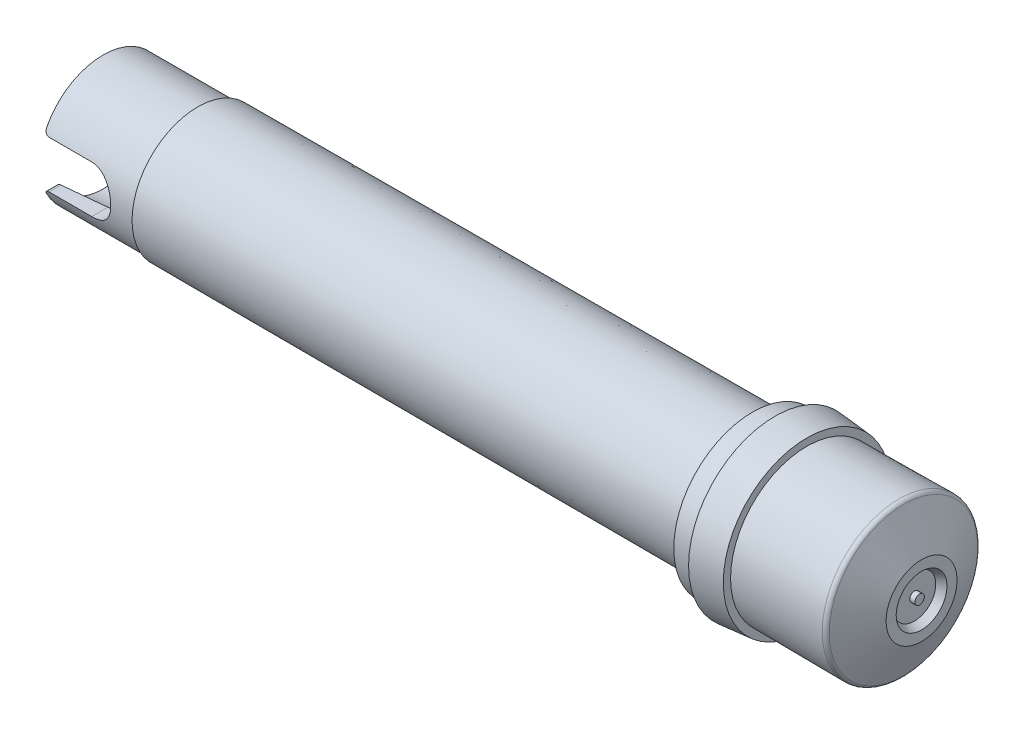
from build123d import *

# Parameters (mm, degrees)
EXTRUS_O1_DEPTH = 5
FILETE1_R       = 0.1
FILETE2_R       = 0.2
FILETE3_R       = 0.03


with BuildPart() as part:
    # Esboço1 → Revolução1 (revolve)
    with BuildSketch(Plane.XY, mode=Mode.PRIVATE) as revolu_o1_sk:
        with BuildLine():
            Line((0, 2.232465991), (0, 2.675))
            Line((0, 2.675), (4, 2.675))
            Line((4, 2.675), (4, 2.775))
            Line((4, 2.775), (27.45, 2.825))
            Line((27.45, 2.825), (27.45, 3.325))
            Line((27.45, 3.325), (28.4, 3.325))
            Line((28.4, 3.325), (28.4, 3.65))
            Line((28.4, 3.65), (29.75, 3.531890304))
            Line((29.75, 3.531890304), (29.75, 3.225))
            Line((29.75, 3.225), (33.653170972, 3.254044116))
            ThreePointArc((33.653170972, 3.254044116), (33.761490772, 3.223126579), (33.83592072, 3.138573305))
            Line((33.83592072, 3.138573305), (34.6, 1.5))
            Line((34.6, 1.5), (34.6, 1.073205081))
            Line((34.6, 1.073205081), (34.3, 0.9))
            Line((34.3, 0.9), (34.3, 0.2))
            Line((34.3, 0.2), (34.517634594, 0.2))
            Line((34.517634594, 0.2), (34.517634594, 0))
            Line((34.517634594, 0), (33.7, 0))
            Line((33.7, 0), (33.7, 1.652085159))
            Line((33.7, 1.652085159), (3, 1.92))
            Line((3, 1.92), (3, 1.97))
            Line((3, 1.97), (0, 2.232465991))
        make_face()
    revolve(revolu_o1_sk.sketch.rotate(Axis((0, 0, 0), (1, 0, 0)), 90), axis=Axis((0, 0, 0), (1, 0, 0)))

    # Esboço2 → Extrusão1 (cut, symmetric)
    with BuildSketch(Plane.XY):
        with BuildLine():
            Line((0, 1), (0, -1))
            Line((0, -1), (2, -1))
            ThreePointArc((2, -1), (3, 0), (2, 1))
            Line((2, 1), (0, 1))
        make_face()
    extrude(amount=EXTRUS_O1_DEPTH, both=True, mode=Mode.SUBTRACT)

    # Filete1
    filete1_edges = [part.edges().sort_by_distance(p)[0] for p in [
        (33.7, 0, -1.652085159),
    ]]
    fillet(filete1_edges, radius=FILETE1_R)

    # Filete2
    filete2_edges = [part.edges().sort_by_distance(p)[0] for p in [
        (0, -1, -2.238512624),
        (0, -1, 2.238512624),
        (0, 1, -2.238512624),
        (0, 1, 2.238512624),
    ]]
    fillet(filete2_edges, radius=FILETE2_R)

    # Filete3
    filete3_edges = [part.edges().sort_by_distance(p)[0] for p in [
        (3, 0, -1.92),
    ]]
    fillet(filete3_edges, radius=FILETE3_R)


solid = part.part
